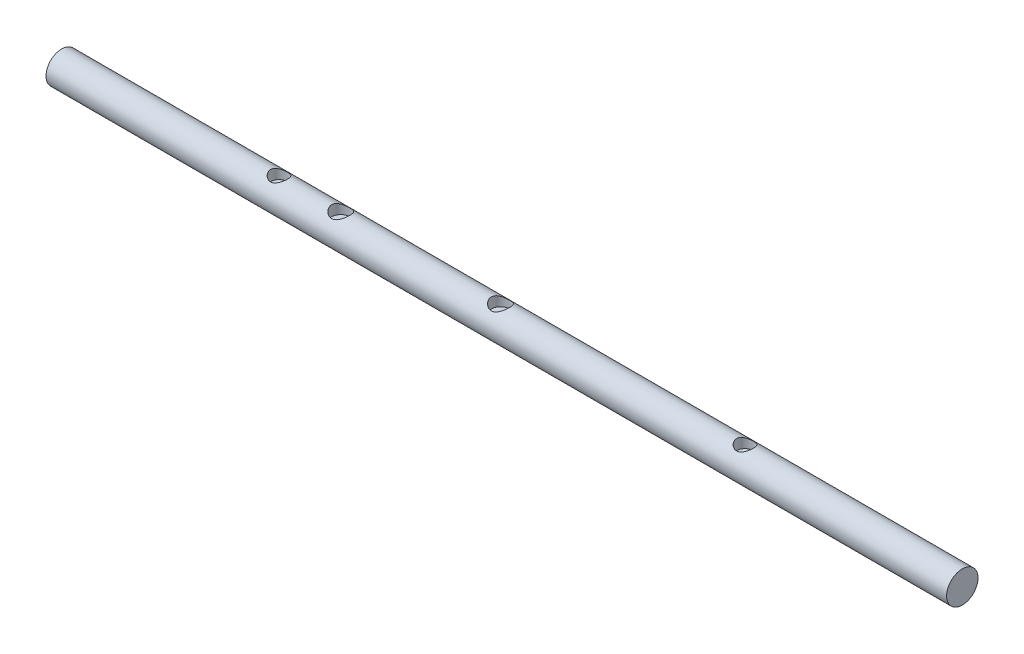
from build123d import *

# Parameters (mm, degrees)
SKETCH1_W          = 172
SKETCH1_H          = 3
SKETCH3_R          = 1.75
SKETCH3_R_2        = 1.6
CUT_EXTRUDE1_DEPTH = 2


with BuildPart() as part:
    # Sketch1 → Revolve1 (revolve)
    with BuildSketch(Plane.XY, mode=Mode.PRIVATE) as revolve1_sk:
        with Locations((-72.807280427, 0.402439024)):
            Rectangle(SKETCH1_W, SKETCH1_H)
    revolve(revolve1_sk.sketch.rotate(Axis((-158.807280427, 1.902439024, 0), (1, 0, 0)), 270), axis=Axis((-158.807280427, 1.902439024, 0), (1, 0, 0)))

    # Sketch3 → Cut-Extrude1 (cut)
    with BuildSketch(Plane(origin=(-158.807280427, 4.902439024, 0), x_dir=(1, 0, 0), z_dir=(0, 1, 0))):
        with Locations(Location((83.8, 0, 0), (0, 0, 270))):
            Circle(SKETCH3_R)
        with Locations(Location((41.5, 0, 0), (0, 0, 270))):
            Circle(SKETCH3_R_2)
        with Locations(Location((53.3, 0, 0), (0, 0, 270))):
            Circle(SKETCH3_R)
        with Locations(Location((130.5, 0, 0), (0, 0, 270))):
            Circle(SKETCH3_R_2)
    extrude(amount=-CUT_EXTRUDE1_DEPTH, mode=Mode.SUBTRACT)


solid = part.part
